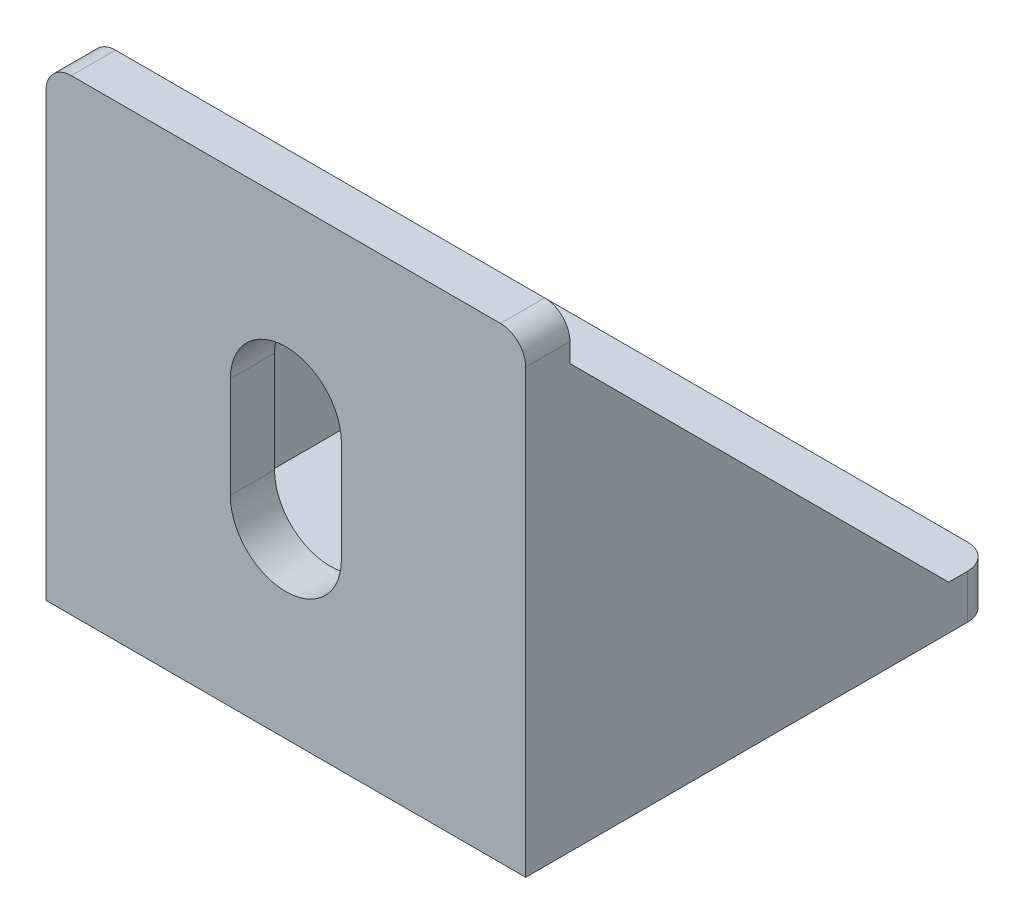
from build123d import *

# Parameters (mm, degrees)
Y_KSEKLIK_EKSTR_ZYON1_DEPTH = 38
IZIM2_W                     = 31
IZIM2_H                     = 30
KES_EKSTR_ZYON1_DEPTH       = 33.5
KES_EKSTR_ZYON2_DEPTH       = 38
KES_EKSTR_ZYON3_DEPTH       = 38
RADYUS2_R                   = 2


with BuildPart() as part:
    # Çizim1 → Yükseklik-Ekstrüzyon1 (new body)
    with BuildSketch(Plane(origin=(0, 0, 0), x_dir=(0, 0, -1), z_dir=(1, 0, 0))):
        Polygon((0, 0), (0, 37), (3.5, 37), (3.5, 33.5), (33.5, 3.5), (37, 3.5), (37, 0), align=None)
    extrude(amount=Y_KSEKLIK_EKSTR_ZYON1_DEPTH)

    # Çizim2 → Kes-Ekstrüzyon1 (cut)
    with BuildSketch(Plane(origin=(0, 0, -37), x_dir=(-1, 0, 0), z_dir=(0, 0, -1))):
        with Locations((-19, 18.5)):
            Rectangle(IZIM2_W, IZIM2_H)
    extrude(amount=-KES_EKSTR_ZYON1_DEPTH, mode=Mode.SUBTRACT)

    # Çizim3 → Kes-Ekstrüzyon2 (cut)
    with BuildSketch(Plane(origin=(0, 0, -3.5), x_dir=(-1, 0, 0), z_dir=(0, 0, -1))):
        with BuildLine():
            Line((-14.6, 22.5), (-14.6, 14.5))
            ThreePointArc((-14.6, 14.5), (-19, 10.1), (-23.4, 14.5))
            Line((-23.4, 14.5), (-23.4, 22.5))
            ThreePointArc((-23.4, 22.5), (-19, 26.9), (-14.6, 22.5))
        make_face()
    extrude(amount=-KES_EKSTR_ZYON2_DEPTH, mode=Mode.SUBTRACT)

    # Çizim4 → Kes-Ekstrüzyon3 (cut)
    with BuildSketch(Plane(origin=(0, 3.5, 0), x_dir=(1, 0, 0), z_dir=(0, 1, 0))):
        with BuildLine():
            Line((23.4, 22.5), (23.4, 14.5))
            ThreePointArc((23.4, 14.5), (19, 10.1), (14.6, 14.5))
            Line((14.6, 14.5), (14.6, 22.5))
            ThreePointArc((14.6, 22.5), (19, 26.9), (23.4, 22.5))
        make_face()
    extrude(amount=-KES_EKSTR_ZYON3_DEPTH, mode=Mode.SUBTRACT)

    # Radyus2
    radyus2_edges = [part.edges().sort_by_distance(p)[0] for p in [
        (38, 37, -1.75),
        (38, 1.75, -37),
        (0, 37, -1.75),
        (0, 1.75, -37),
    ]]
    fillet(radyus2_edges, radius=RADYUS2_R)


solid = part.part
